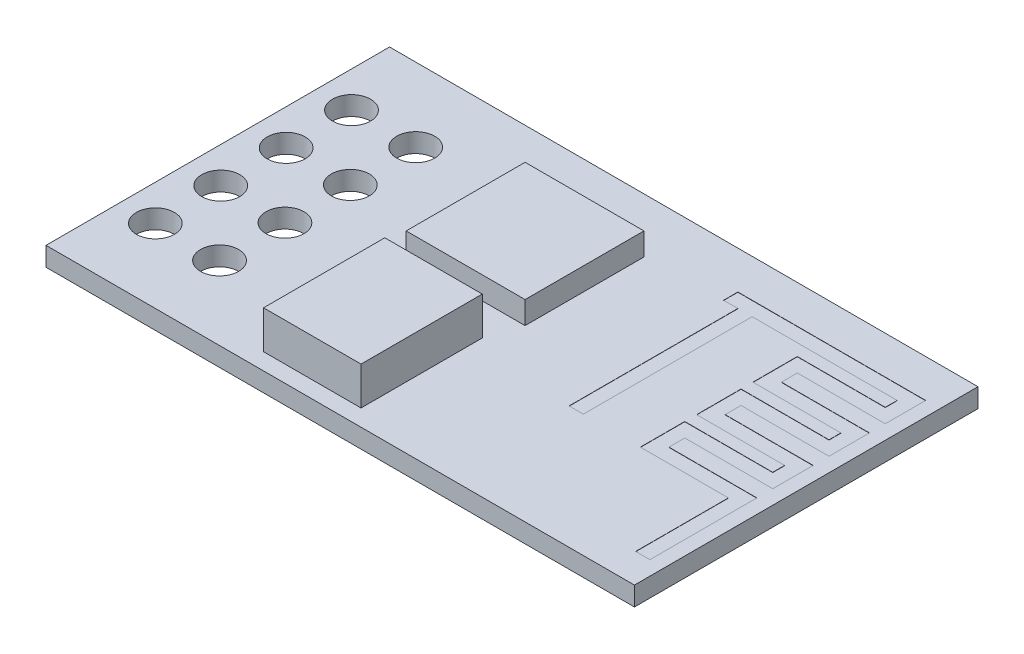
from build123d import *

# Parameters (mm, degrees)
ESQUISSE1_W             = 24.75
ESQUISSE1_H             = 14.45
BOSS_EXTRU_1_DEPTH      = 0.8
ESQUISSE2_W             = 5
ESQUISSE2_H             = 5
BOSS_EXTRU_2_DEPTH      = 0.95
ESQUISSE4_W             = 4.1
ESQUISSE4_H             = 5.1
BOSS_EXTRU_3_DEPTH      = 1.6
ESQUISSE5_R             = 0.8
ENL_V_MAT_EXTRU_1_DEPTH = 1.6
ENL_V_MAT_EXTRU_2_DEPTH = 0.01


with BuildPart() as part:
    # Esquisse1 → Boss.-Extru.1 (new body)
    with BuildSketch(Plane(origin=(0, 0, 0), x_dir=(1, 0, 0), z_dir=(0, 1, 0))):
        Rectangle(ESQUISSE1_W, ESQUISSE1_H)
    extrude(amount=BOSS_EXTRU_1_DEPTH)

    # Esquisse2 → Boss.-Extru.2 (add)
    with BuildSketch(Plane(origin=(0, 0.8, 0), x_dir=(1, 0, 0), z_dir=(0, 1, 0))):
        with Locations((-1.875, 2.425)):
            Rectangle(ESQUISSE2_W, ESQUISSE2_H)
    extrude(amount=BOSS_EXTRU_2_DEPTH)

    # Esquisse4 → Boss.-Extru.3 (add)
    with BuildSketch(Plane(origin=(0, 0.8, 0), x_dir=(1, 0, 0), z_dir=(0, 1, 0))):
        with Locations((-1.875, -3.975)):
            Rectangle(ESQUISSE4_W, ESQUISSE4_H)
    extrude(amount=BOSS_EXTRU_3_DEPTH)

    # Esquisse5 → Enlèv. mat.-Extru.1 (cut)
    with BuildSketch(Plane(origin=(0, 0.8, 0), x_dir=(1, 0, 0), z_dir=(0, 1, 0))):
        with Locations(Location((-10.875, -4.125, 0), (0, 0, 270))):
            Circle(ESQUISSE5_R)
        with Locations(Location((-10.875, -1.375, 0), (0, 0, 270))):
            Circle(ESQUISSE5_R)
        with Locations(Location((-10.875, 1.375, 0), (0, 0, 270))):
            Circle(ESQUISSE5_R)
        with Locations(Location((-10.875, 4.125, 0), (0, 0, 270))):
            Circle(ESQUISSE5_R)
        with Locations(Location((-8.175, 4.125, 0), (0, 0, 270))):
            Circle(ESQUISSE5_R)
        with Locations(Location((-8.175, 1.375, 0), (0, 0, 270))):
            Circle(ESQUISSE5_R)
        with Locations(Location((-8.175, -1.375, 0), (0, 0, 270))):
            Circle(ESQUISSE5_R)
        with Locations(Location((-8.175, -4.125, 0), (0, 0, 270))):
            Circle(ESQUISSE5_R)
    extrude(amount=-ENL_V_MAT_EXTRU_1_DEPTH, mode=Mode.SUBTRACT)

    # Esquisse6 → Enlèv. mat.-Extru.2 (cut)
    with BuildSketch(Plane(origin=(0, 0.8, 0), x_dir=(1, 0, 0), z_dir=(0, 1, 0))):
        Polygon((3.875, 5.625), (11.775, 5.625), (11.775, 3.925), (8.075, 3.925), (8.075, 3.258333333), (11.775, 3.258333333), (11.775, 1.558333333), (8.075, 1.558333333), (8.075, 0.891666667), (11.775, 0.891666667), (11.775, -0.808333333), (8.075, -0.808333333), (8.075, -1.475), (11.775, -1.475), (11.775, -5.975), (11.175, -5.975), (11.175, -2.075), (7.475, -2.075), (7.475, -0.208333333), (11.175, -0.208333333), (11.175, 0.291666667), (7.475, 0.291666667), (7.475, 2.158333333), (11.175, 2.158333333), (11.175, 2.658333333), (7.475, 2.658333333), (7.475, 4.525), (11.175, 4.525), (11.175, 5.025), (5.075, 5.025), (5.075, -2.075), (4.475, -2.075), (4.475, 5.025), (3.875, 5.025), align=None)
    extrude(amount=-ENL_V_MAT_EXTRU_2_DEPTH, mode=Mode.SUBTRACT)


solid = part.part
